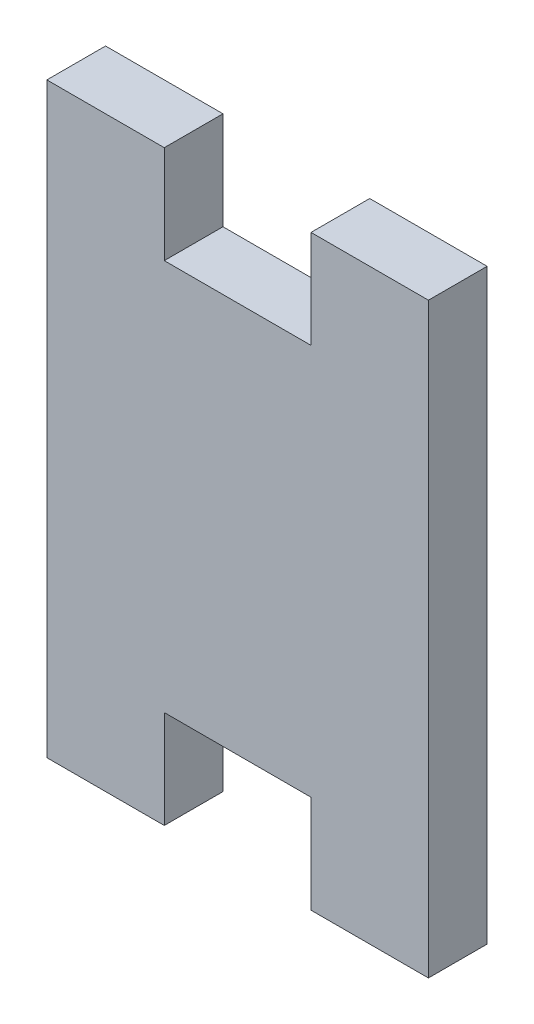
from build123d import *

# Parameters (mm, degrees)
RESSALTO_EXTRUS_O1_DEPTH = 3


with BuildPart() as part:
    # Esboço1 → Ressalto-extrusão1 (new body)
    with BuildSketch(Plane.XY):
        Polygon((9.75, -85.228467857), (9.75, -60.228467857), (9.75, -55.228467857), (3.75, -55.228467857), (3.75, -60.228467857), (-3.75, -60.228467857), (-3.75, -55.228467857), (-9.75, -55.228467857), (-9.75, -60.228467857), (-9.75, -85.228467857), (-3.75, -85.228467857), (-3.75, -80.228467857), (3.75, -80.228467857), (3.75, -85.228467857), align=None)
    extrude(amount=RESSALTO_EXTRUS_O1_DEPTH)


solid = part.part
